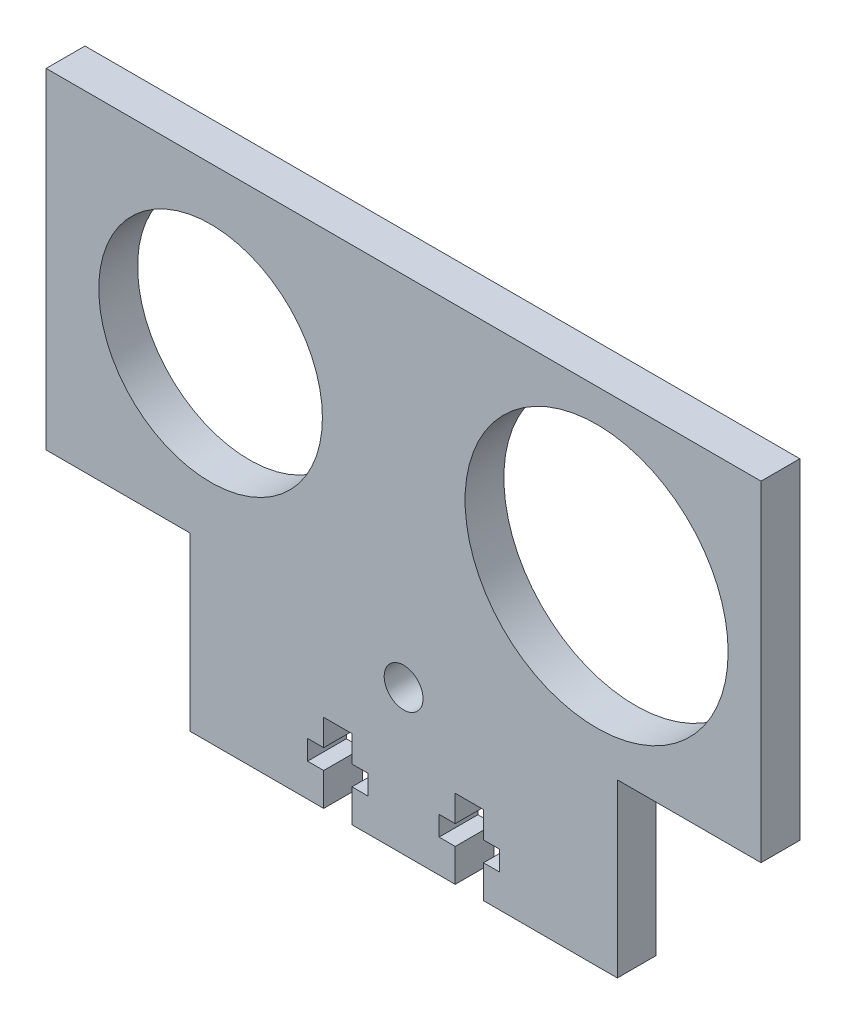
from build123d import *

# Parameters (mm, degrees)
SKETCH1_R           = 2.95
SKETCH1_R_2         = 17
SKETCH1_R_3         = 20
BOSS_EXTRUDE1_DEPTH = 5.9
CUT_EXTRUDE2_DEPTH  = 78.081470808


with BuildPart() as part:
    # Sketch1 → Boss-Extrude1 (new body)
    with BuildSketch(Plane.XY):
        Polygon((-32.5, 4.1), (-32.5, -22), (32.5, -22), (32.5, 4.1), (54.344931419, 4.1), (54.344931419, 54.344931419), (-54.344931419, 54.344931419), (-54.344931419, 4.1), align=None)
        Circle(SKETCH1_R, mode=Mode.SUBTRACT)
        with Locations((-29.344931419, 29.344931419)):
            Circle(SKETCH1_R_2, mode=Mode.SUBTRACT)
        with Locations((29.344931419, 29.344931419)):
            Circle(SKETCH1_R_3, mode=Mode.SUBTRACT)
    extrude(amount=BOSS_EXTRUDE1_DEPTH)

    # Sketch3 → Cut-Extrude2 (cut, through all)
    with BuildSketch(Plane.XY.offset(5.9)):
        Polygon((-12.15, -22), (-7.85, -22), (-7.85, -17), (-5.4, -17), (-5.4, -14), (-7.85, -14), (-7.85, -10), (-12.15, -10), (-12.15, -14), (-14.6, -14), (-14.6, -17), (-12.15, -17), align=None)
        Polygon((7.85, -14), (7.85, -10), (12.15, -10), (12.15, -14), (14.6, -14), (14.6, -17), (12.15, -17), (12.15, -22), (7.85, -22), (7.85, -17), (5.4, -17), (5.4, -14), align=None)
    extrude(amount=-CUT_EXTRUDE2_DEPTH, mode=Mode.SUBTRACT)


solid = part.part
